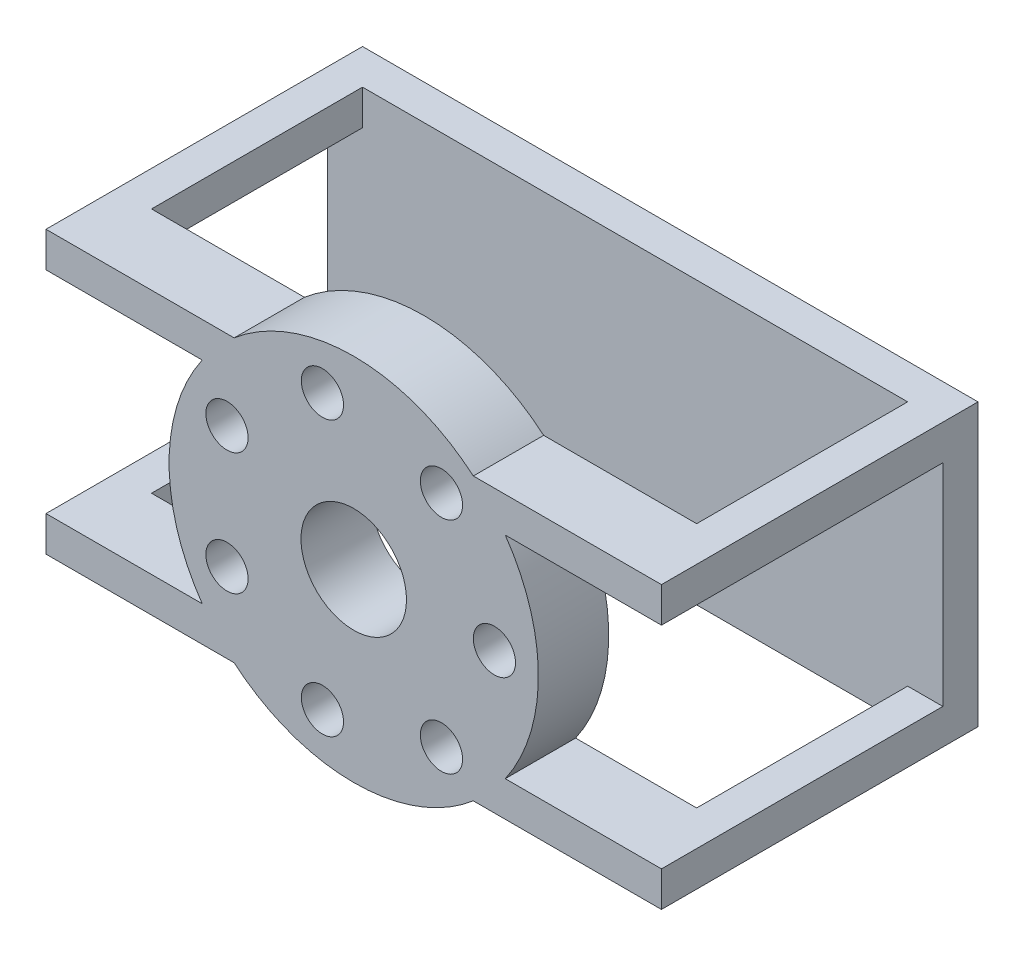
from build123d import *

# Parameters (mm, degrees)
SKETCH2_W           = 175
SKETCH2_H           = 90
SKETCH2_W_2         = 155
SKETCH2_H_2         = 60
BOSS_EXTRUDE3_DEPTH = 52.5
SKETCH3_R           = 6
SKETCH3_R_2         = 15
CUT_EXTRUDE1_DEPTH  = 80
SKETCH4_W           = 175
SKETCH4_H           = 12.5
CUT_EXTRUDE2_DEPTH  = 10


with BuildPart() as part:
    # Sketch2 → Boss-Extrude3 (new, symmetric)
    with BuildSketch(Plane(origin=(0, 0, 0), x_dir=(1, 0, 0), z_dir=(0, 1, 0))):
        with Locations((0, 45)):
            Rectangle(SKETCH2_W, SKETCH2_H)
        with Locations((0, 50)):
            Rectangle(SKETCH2_W_2, SKETCH2_H_2, mode=Mode.SUBTRACT)
    extrude(amount=BOSS_EXTRUDE3_DEPTH, both=True)

    # Sketch3 → Cut-Extrude1 (cut)
    with BuildSketch(Plane.XY):
        with BuildLine():
            Line((-87.5, 52.5), (-87.5, 40))
            Line((-87.5, 40), (-34.003676272, 40))
            ThreePointArc((-34.003676272, 40), (-18.114220897, 49.276008374), (7.6e-08, 52.5))
            Line((7.6e-08, 52.5), (-87.5, 52.5))
        make_face()
        with BuildLine():
            Line((87.5, 52.5), (7.6e-08, 52.5))
            ThreePointArc((7.6e-08, 52.5), (18.114220968, 49.276008348), (34.003676272, 40))
            Line((34.003676272, 40), (87.5, 40))
            Line((87.5, 40), (87.5, 52.5))
        make_face()
        with BuildLine():
            Line((-34.003676272, -40), (-87.5, -40))
            Line((-87.5, -40), (-87.5, -52.5))
            Line((-87.5, -52.5), (0, -52.5))
            ThreePointArc((0, -52.5), (-18.114220933, -49.276008361), (-34.003676272, -40))
        make_face()
        with BuildLine():
            ThreePointArc((34.003676272, -40), (18.114220933, -49.276008361), (0, -52.5))
            Line((0, -52.5), (87.5, -52.5))
            Line((87.5, -52.5), (87.5, -40))
            Line((87.5, -40), (34.003676272, -40))
        make_face()
        with BuildLine():
            Line((87.5, 30), (43.084219849, 30))
            ThreePointArc((43.084219849, 30), (50.090775309, 15.721457597), (52.5, 0))
            ThreePointArc((52.5, 0), (50.090775309, -15.721457597), (43.084219849, -30))
            Line((43.084219849, -30), (87.5, -30))
            Line((87.5, -30), (87.5, 30))
        make_face()
        with BuildLine():
            Line((-43.084219849, 30), (-87.5, 30))
            Line((-87.5, 30), (-87.5, -30))
            Line((-87.5, -30), (-43.084219849, -30))
            ThreePointArc((-43.084219849, -30), (-52.5, 0), (-43.084219849, 30))
        make_face()
        with Locations((-8.900837358, 38.997116487)):
            Circle(SKETCH3_R)
        with Locations((24.939592074, 31.273259299)):
            Circle(SKETCH3_R)
        with Locations((-36.038754716, 17.355349565)):
            Circle(SKETCH3_R)
        with Locations((40, 0)):
            Circle(SKETCH3_R)
        with Locations((-36.038754716, -17.355349565)):
            Circle(SKETCH3_R)
        with Locations((-8.900837358, -38.997116487)):
            Circle(SKETCH3_R)
        with Locations((24.939592074, -31.273259299)):
            Circle(SKETCH3_R)
        Circle(SKETCH3_R_2)
    extrude(amount=-CUT_EXTRUDE1_DEPTH, mode=Mode.SUBTRACT)

    # Sketch4 → Cut-Extrude2 (cut)
    with BuildSketch(Plane.XY.offset(-80)):
        with Locations((0, 46.25)):
            Rectangle(SKETCH4_W, SKETCH4_H)
        with Locations((0, -46.25)):
            Rectangle(SKETCH4_W, SKETCH4_H)
    extrude(amount=-CUT_EXTRUDE2_DEPTH, mode=Mode.SUBTRACT)


solid = part.part
